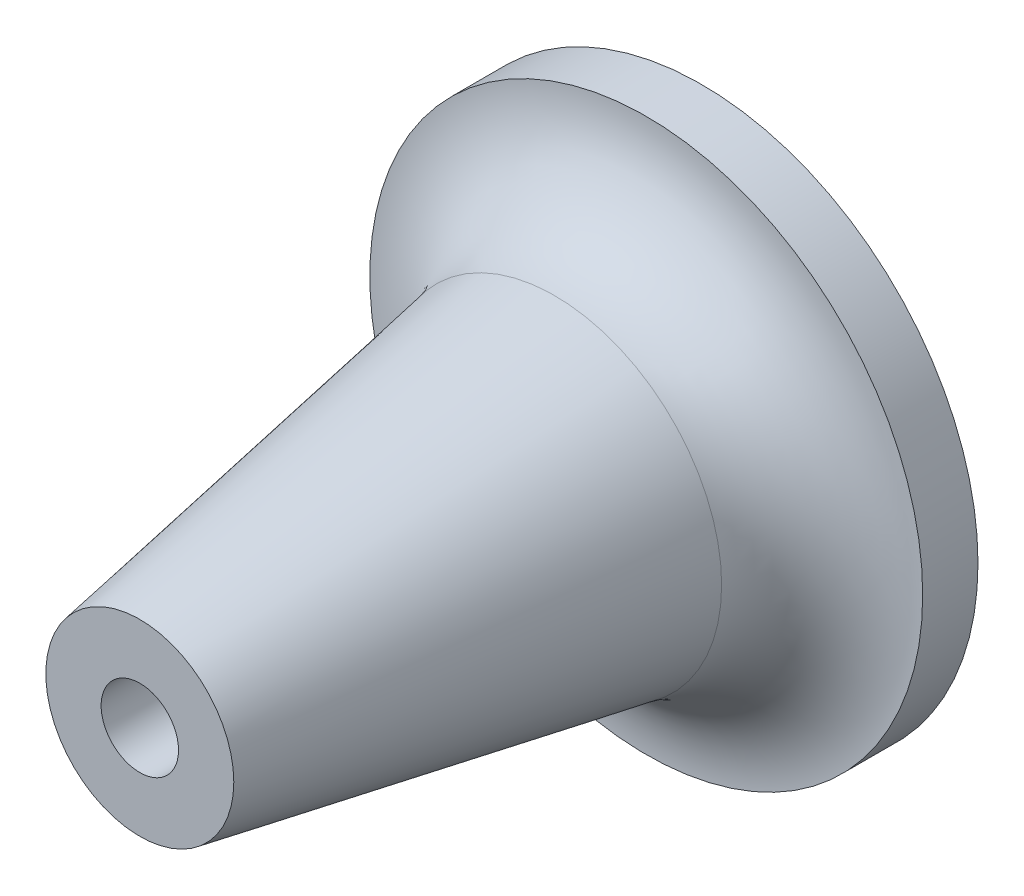
from build123d import *


with BuildPart() as part:
    # Sketch1 → Revolve1 (revolve)
    with BuildSketch(Plane(origin=(0, 0, 0), x_dir=(0, 0, -1), z_dir=(1, 0, 0)), mode=Mode.PRIVATE) as revolve1_sk:
        with BuildLine():
            Line((-33.715360463, 3.5), (-28.715360463, 3.5))
            Line((-28.715360463, 3.5), (10.584639537, 11.1))
            Line((10.584639537, 11.1), (17.084639537, 11.1))
            Line((17.084639537, 11.1), (17.084639537, 25))
            Line((17.084639537, 25), (12.084639537, 25))
            ThreePointArc((12.084639537, 25), (9.735819432, 18.5466698), (3.788398149, 15.112924521))
            Line((3.788398149, 15.112924521), (-33.715360463, 8.5))
            Line((-33.715360463, 8.5), (-33.715360463, 3.5))
        make_face()
    revolve(revolve1_sk.sketch.rotate(Axis((0, 0, 51.495497957), (0, 0, -1)), 90), axis=Axis((0, 0, 51.495497957), (0, 0, -1)))


solid = part.part
